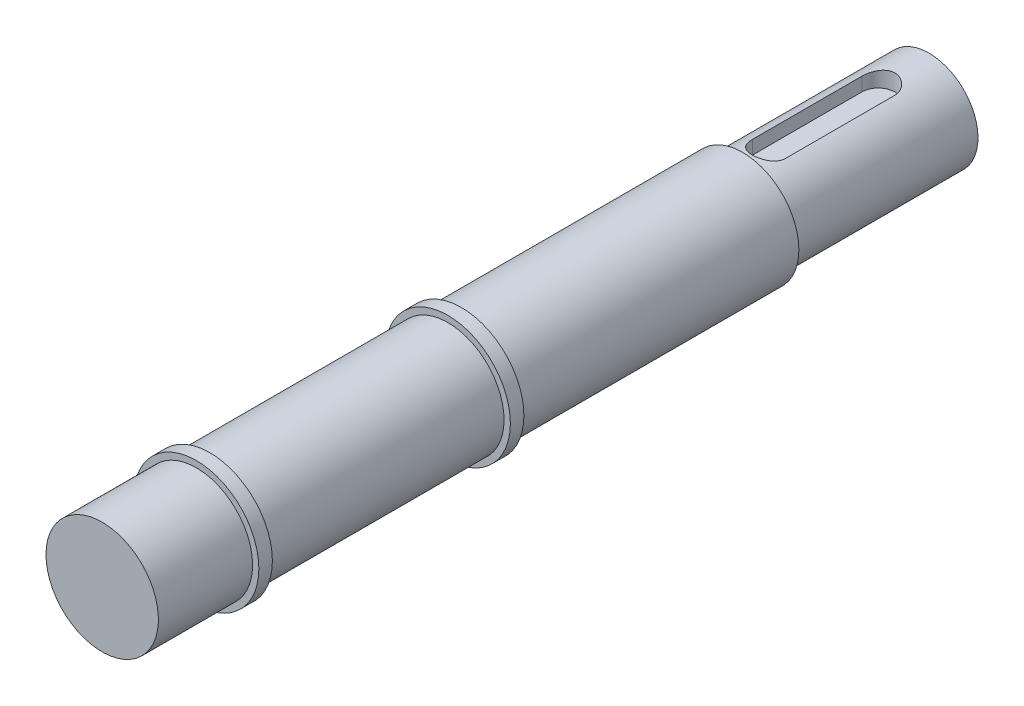
from build123d import *

# Parameters (mm, degrees)
SKETCH_1_R          = 7.4
EXTRUDE_1_DEPTH     = 28.2
EXTRUDE_START       = 28.2
SKETCH_1_5_R        = 8.5
EXTRUDE_2_DEPTH     = 42.55
EXTRUDE_START_2     = 70.75
SKETCH_1_7_R        = 9.45
EXTRUDE_3_DEPTH     = 2.05
EXTRUDE_START_3     = 108.8
SKETCH_1_8_R        = 9.45
EXTRUDE_4_DEPTH     = 2.05
EXTRUDE_START_4     = 72.8
SKETCH_1_9_R        = 8.5
EXTRUDE_5_DEPTH     = 36
EXTRUDE_START_5     = 110.85
SKETCH_1_10_R       = 8.5
EXTRUDE_6_DEPTH     = 14.25
CUT_EXTRUDE_START   = 7.4
CUT_EXTRUDE_1_DEPTH = 2.5


with BuildPart() as part:
    # 草图1 → 凸台-拉伸1 (new body)
    with BuildSketch(Plane.XY):
        Circle(SKETCH_1_R)
    extrude(amount=EXTRUDE_1_DEPTH)

    # 草图1<5> → 凸台-拉伸2 (add)
    with BuildSketch(Plane.XY.offset(EXTRUDE_START)):
        Circle(SKETCH_1_5_R)
    extrude(amount=EXTRUDE_2_DEPTH)

    # 草图1<7> → 凸台-拉伸3 (add)
    with BuildSketch(Plane.XY.offset(EXTRUDE_START_2)):
        Circle(SKETCH_1_7_R)
    extrude(amount=EXTRUDE_3_DEPTH)



with BuildPart() as body_2:
    # 草图1<8> → 凸台-拉伸4 (new body)
    with BuildSketch(Plane.XY.offset(EXTRUDE_START_3)):
        Circle(SKETCH_1_8_R)
    extrude(amount=EXTRUDE_4_DEPTH)


with BuildPart() as part_1:
    add(part.part)

    add(body_2.part)  # 凸台-拉伸5 merges body 2
    # 草图1<9> → 凸台-拉伸5 (add)
    with BuildSketch(Plane.XY.offset(EXTRUDE_START_4)):
        Circle(SKETCH_1_9_R)
    extrude(amount=EXTRUDE_5_DEPTH)

    # 草图1<10> → 凸台-拉伸6 (add)
    with BuildSketch(Plane.XY.offset(EXTRUDE_START_5)):
        Circle(SKETCH_1_10_R)
    extrude(amount=EXTRUDE_6_DEPTH)

    # 草图11 → 切除-拉伸1 (cut)
    with BuildSketch(Plane(origin=(0, 0, 0), x_dir=(1, 0, 0), z_dir=(0, 1, 0)).offset(CUT_EXTRUDE_START)):
        with BuildLine():
            Line((2.5, -7.68), (2.5, -24.22))
            ThreePointArc((2.5, -24.22), (0, -26.72), (-2.5, -24.22))
            Line((-2.5, -24.22), (-2.5, -7.68))
            ThreePointArc((-2.5, -7.68), (0, -5.18), (2.5, -7.68))
        make_face()
    extrude(amount=-CUT_EXTRUDE_1_DEPTH, mode=Mode.SUBTRACT)


solid = part_1.part
